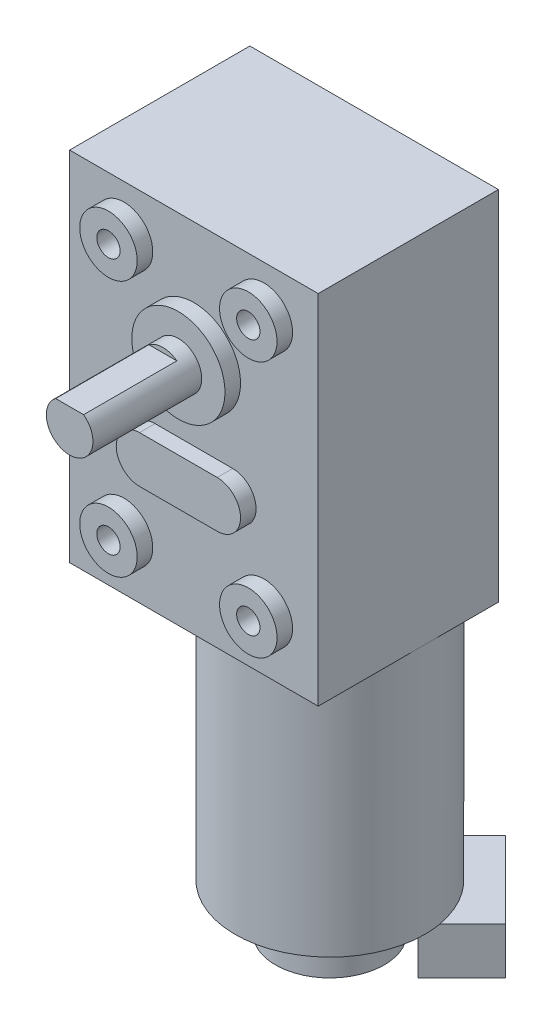
from build123d import *

# Parameters (mm, degrees)
SKETCH_372_W           = 32
SKETCH_372_H           = 46
EXTRUDE_487_DEPTH      = 23.2
SKETCH_1_R             = 12.2
EXTRUDE_677_DEPTH      = 30.8
SKETCH_726_R           = 3.7
EXTRUDE_1207_DEPTH     = 2
SKETCH_904_R           = 6
EXTRUDE_1247_DEPTH     = 2
EXTRUDE_1287_DEPTH     = 2
SKETCH_6_R             = 3
EXTRUDE_1383_DEPTH     = 14
CUT_EXTRUDE_START      = -12
CUT_EXTRUDE_1539_DEPTH = 12
SKETCH_1587_R          = 1.5
CUT_EXTRUDE_1690_DEPTH = 5
SKETCH_1732_R          = 12.2
EXTRUDE_1777_DEPTH     = 1.5
SKETCH_10_R            = 7
EXTRUDE_1879_DEPTH     = 6
EXTRUDE_2129_DEPTH     = 6


with BuildPart() as part:
    # Sketch 372 → Extrude 487 (new body)
    with BuildSketch(Plane.XY):
        with Locations((0, -8)):
            Rectangle(SKETCH_372_W, SKETCH_372_H)
    extrude(amount=EXTRUDE_487_DEPTH)

    # Эскиз1 → Extrude 677 (add)
    with BuildSketch(Plane.XZ.offset(31)):
        with Locations((3.8, 9.5)):
            Circle(SKETCH_1_R)
    extrude(amount=EXTRUDE_677_DEPTH)

    # Sketch 726 → Extrude 1207 (add)
    with BuildSketch(Plane.XY.offset(23.2)):
        with Locations((-9, 9)):
            Circle(SKETCH_726_R)
        with Locations((9, 9)):
            Circle(SKETCH_726_R)
        with Locations((9, -24)):
            Circle(SKETCH_726_R)
        with Locations((-9, -24)):
            Circle(SKETCH_726_R)
    extrude(amount=EXTRUDE_1207_DEPTH)

    # Sketch 904 → Extrude 1247 (add)
    with BuildSketch(Plane.XY.offset(23.2)):
        Circle(SKETCH_904_R)
    extrude(amount=EXTRUDE_1247_DEPTH)

    # Sketch 1024 → Extrude 1287 (add)
    with BuildSketch(Plane.XY.offset(23.2)):
        with BuildLine():
            Line((-5, -10), (5, -10))
            ThreePointArc((5, -10), (8, -13), (5, -16))
            Line((5, -16), (-5, -16))
            ThreePointArc((-5, -16), (-8, -13), (-5, -10))
        make_face()
    extrude(amount=EXTRUDE_1287_DEPTH)

    # Эскиз6 → Extrude 1383 (add)
    with BuildSketch(Plane.XY.offset(25.2)):
        Circle(SKETCH_6_R)
    extrude(amount=EXTRUDE_1383_DEPTH)

    # d-вал → Cut-Extrude 1539 (cut)
    with BuildSketch(Plane.XY.offset(39.2).offset(CUT_EXTRUDE_START)):
        with BuildLine():
            Line((-1.8, 2.4), (1.8, 2.4))
            ThreePointArc((1.8, 2.4), (0, 3), (-1.8, 2.4))
        make_face()
    extrude(amount=CUT_EXTRUDE_1539_DEPTH, mode=Mode.SUBTRACT)

    # Sketch 1587 → Cut-Extrude 1690 (cut)
    with BuildSketch(Plane.XY.offset(25.2)):
        with Locations((9, 9)):
            Circle(SKETCH_1587_R)
        with Locations((9, -24)):
            Circle(SKETCH_1587_R)
        with Locations((-9, 9)):
            Circle(SKETCH_1587_R)
        with Locations((-9, -24)):
            Circle(SKETCH_1587_R)
    extrude(amount=-CUT_EXTRUDE_1690_DEPTH, mode=Mode.SUBTRACT)

    # Sketch 1732 → Extrude 1777 (add)
    with BuildSketch(Plane.XZ.offset(61.8)):
        with Locations((3.8, 9.5)):
            Circle(SKETCH_1732_R)
    extrude(amount=EXTRUDE_1777_DEPTH)

    # Эскиз10 → Extrude 1879 (add)
    with BuildSketch(Plane.XZ.offset(63.3)):
        with Locations(Location((3.8, 9.5, 0), (0, 0, 270))):
            Circle(SKETCH_10_R)
    extrude(amount=EXTRUDE_1879_DEPTH)

    # Sketch 1921 → Extrude 2129 (add)
    with BuildSketch(Plane.XZ.offset(63.3)):
        Polygon((14.406601718, 8.792893219), (20.063455967, 3.136038969), (10.163961031, -6.763455967), (4.507106781, -1.106601718), align=None)
    extrude(amount=EXTRUDE_2129_DEPTH)


solid = part.part
